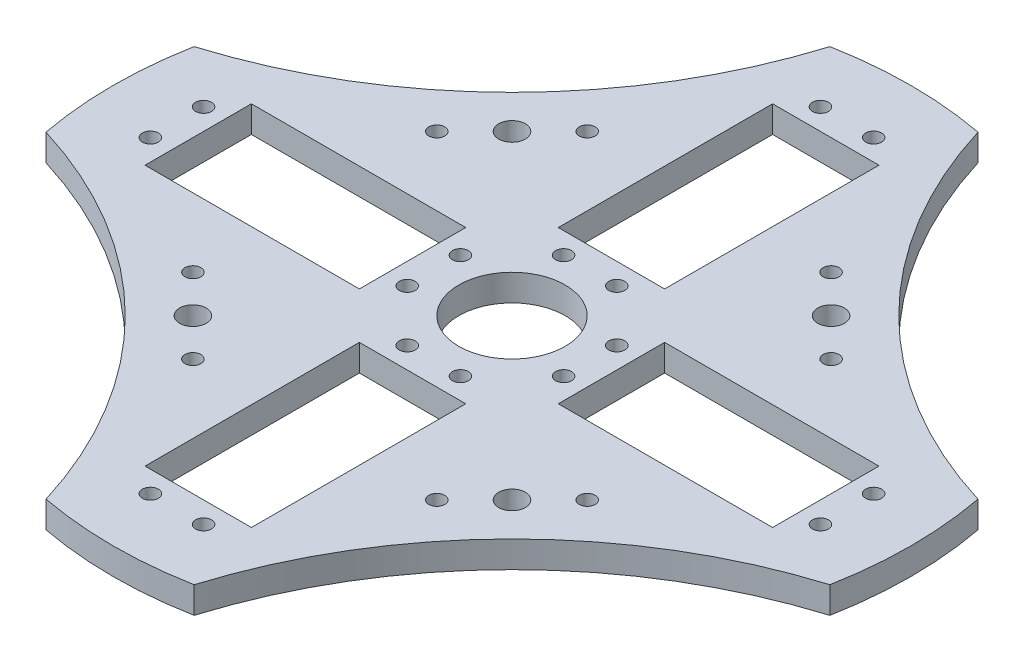
from build123d import *

# Parameters (mm, degrees)
SKETCH1_R           = 75
BOSS_EXTRUDE1_DEPTH = 5
SKETCH3_R           = 1.5
SKETCH3_W           = 40.3
SKETCH3_H           = 20
SKETCH3_W_2         = 20
SKETCH3_H_2         = 40.3
CUT_EXTRUDE1_DEPTH  = 5
SKETCH4_R           = 90
CUT_EXTRUDE2_DEPTH  = 5
SKETCH5_R           = 2.5
SKETCH5_R_2         = 10
SKETCH5_R_3         = 1.5
CUT_EXTRUDE3_DEPTH  = 5


with BuildPart() as part:
    # Sketch1 → Boss-Extrude1 (new body)
    with BuildSketch(Plane(origin=(0, 0, 0), x_dir=(1, 0, 0), z_dir=(0, 1, 0))):
        Circle(SKETCH1_R)
    extrude(amount=BOSS_EXTRUDE1_DEPTH)

    # Sketch3 → Cut-Extrude1 (cut)
    with BuildSketch(Plane(origin=(0, 5, 0), x_dir=(1, 0, 0), z_dir=(0, 1, 0))):
        with Locations((-14.7, 5)):
            Circle(SKETCH3_R)
        with Locations((-14.7, -5)):
            Circle(SKETCH3_R)
        with Locations((-63, 5)):
            Circle(SKETCH3_R)
        with Locations((-63, -5)):
            Circle(SKETCH3_R)
        with Locations((-5, -14.7)):
            Circle(SKETCH3_R)
        with Locations((5, -14.7)):
            Circle(SKETCH3_R)
        with Locations((14.7, 5)):
            Circle(SKETCH3_R)
        with Locations((14.7, -5)):
            Circle(SKETCH3_R)
        with Locations((-5, 14.7)):
            Circle(SKETCH3_R)
        with Locations((5, 14.7)):
            Circle(SKETCH3_R)
        with Locations((-5, -63)):
            Circle(SKETCH3_R)
        with Locations((5, -63)):
            Circle(SKETCH3_R)
        with Locations((63, 5)):
            Circle(SKETCH3_R)
        with Locations((63, -5)):
            Circle(SKETCH3_R)
        with Locations((-5, 63)):
            Circle(SKETCH3_R)
        with Locations((5, 63)):
            Circle(SKETCH3_R)
        with Locations((-38.85, 0)):
            Rectangle(SKETCH3_W, SKETCH3_H)
        with Locations((38.85, 0)):
            Rectangle(SKETCH3_W, SKETCH3_H)
        with Locations((0, 38.85)):
            Rectangle(SKETCH3_W_2, SKETCH3_H_2)
        with Locations((0, -38.85)):
            Rectangle(SKETCH3_W_2, SKETCH3_H_2)
    extrude(amount=-CUT_EXTRUDE1_DEPTH, mode=Mode.SUBTRACT)

    # Sketch4 → Cut-Extrude2 (cut)
    with BuildSketch(Plane(origin=(0, 5, 0), x_dir=(1, 0, 0), z_dir=(0, 1, 0))):
        with Locations((-100, 100)):
            Circle(SKETCH4_R)
        with Locations((100, 100)):
            Circle(SKETCH4_R)
        with Locations((100, -100)):
            Circle(SKETCH4_R)
        with Locations((-100, -100)):
            Circle(SKETCH4_R)
    extrude(amount=-CUT_EXTRUDE2_DEPTH, mode=Mode.SUBTRACT)

    # Sketch5 → Cut-Extrude3 (cut)
    with BuildSketch(Plane(origin=(0, 5, 0), x_dir=(1, 0, 0), z_dir=(0, 1, 0))):
        with Locations((-30, 30)):
            Circle(SKETCH5_R)
        with Locations((30, 30)):
            Circle(SKETCH5_R)
        with Locations((30, -30)):
            Circle(SKETCH5_R)
        with Locations((-30, -30)):
            Circle(SKETCH5_R)
        Circle(SKETCH5_R_2)
        with Locations((-37.071067812, -22.928932188)):
            Circle(SKETCH5_R_3)
        with Locations((-22.928932188, -37.071067812)):
            Circle(SKETCH5_R_3)
        with Locations((22.928932188, -37.071067812)):
            Circle(SKETCH5_R_3)
        with Locations((37.071067812, -22.928932188)):
            Circle(SKETCH5_R_3)
        with Locations((37.071067812, 22.928932188)):
            Circle(SKETCH5_R_3)
        with Locations((22.928932188, 37.071067812)):
            Circle(SKETCH5_R_3)
        with Locations((-22.928932188, 37.071067812)):
            Circle(SKETCH5_R_3)
        with Locations((-37.071067812, 22.928932188)):
            Circle(SKETCH5_R_3)
    extrude(amount=-CUT_EXTRUDE3_DEPTH, mode=Mode.SUBTRACT)


solid = part.part
